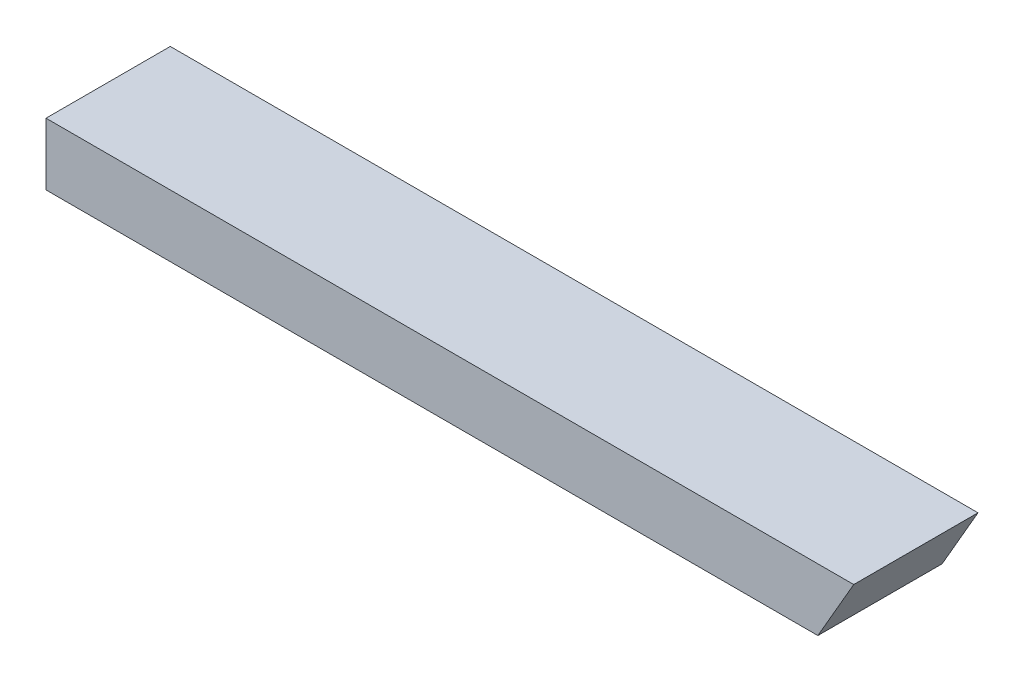
from build123d import *

# Parameters (mm, degrees)
SKETCH1_W           = 82.55
SKETCH1_H           = 12.7
BOSS_EXTRUDE1_DEPTH = 3.175
CUT_EXTRUDE1_DEPTH  = 31.115


with BuildPart() as part:
    # Sketch1 → Boss-Extrude1 (new, symmetric)
    with BuildSketch(Plane(origin=(0, 0, 0), x_dir=(1, 0, 0), z_dir=(0, 1, 0))):
        Rectangle(SKETCH1_W, SKETCH1_H)
    extrude(amount=BOSS_EXTRUDE1_DEPTH, both=True)

    # Sketch2 → Cut-Extrude1 (cut, symmetric)
    with BuildSketch(Plane.XY.offset(6.35)):
        Polygon((41.275, 3.175), (37.608825791, -3.175), (41.275, -3.175), align=None)
    extrude(amount=CUT_EXTRUDE1_DEPTH, both=True, mode=Mode.SUBTRACT)


solid = part.part
